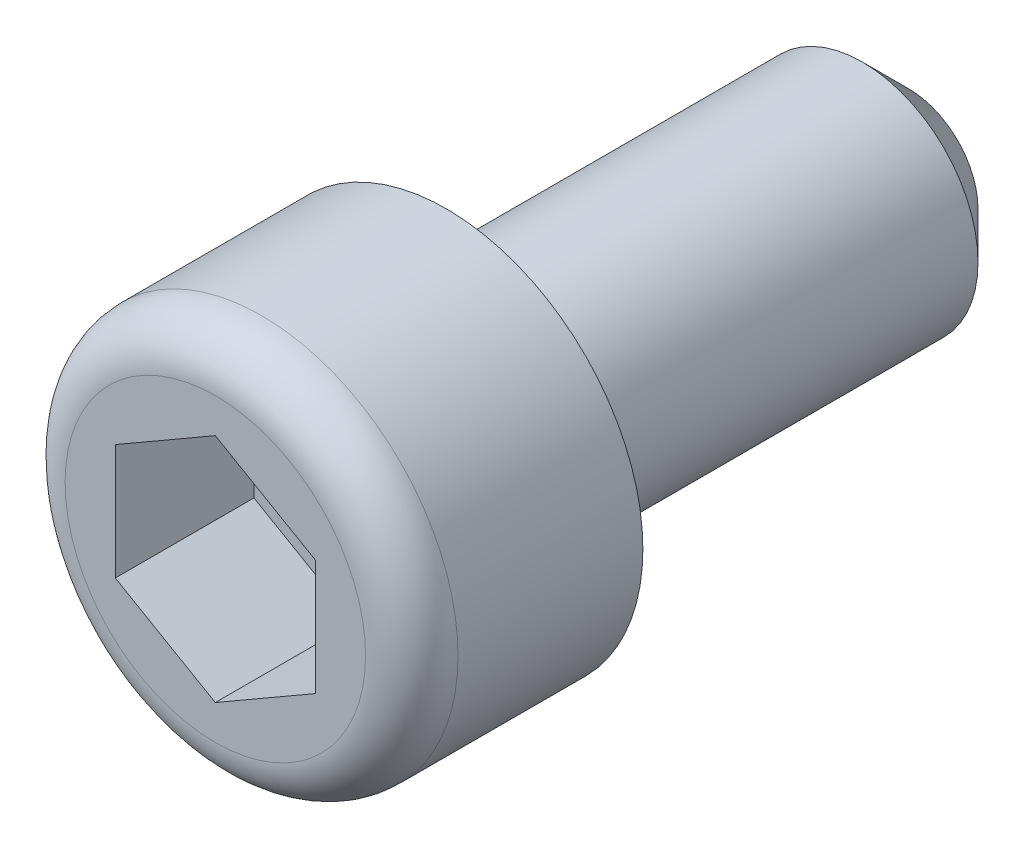
from build123d import *

# Parameters (mm, degrees)
FOOTPRINT_DEPTH = 3
CHAMFER1_SIZE   = 1
FILLET1_R       = 1


with BuildPart() as part:
    # Sketch1 → Body (revolve)
    with BuildSketch(Plane(origin=(0, 0, 0), x_dir=(0, 0, -1), z_dir=(1, 0, 0)), mode=Mode.PRIVATE) as body_sk:
        Polygon((0, 0), (0, 4.25), (5, 4.25), (5, 2.5), (15, 2.5), (15, 0), align=None)
    revolve(body_sk.sketch.rotate(Axis((0, 0, 156.291575099), (0, 0, -1)), 90), axis=Axis((0, 0, 156.291575099), (0, 0, -1)))

    # Sketch2 → Footprint (cut)
    with BuildSketch(Plane.XY):
        Polygon((0, 2.5), (-2.165063509, 1.25), (-2.165063509, -1.25), (0, -2.5), (2.165063509, -1.25), (2.165063509, 1.25), align=None)
    extrude(amount=-FOOTPRINT_DEPTH, mode=Mode.SUBTRACT)

    # Chamfer1
    chamfer1_edges = [part.edges().sort_by_distance(p)[0] for p in [
        (-2.5, 0, -15),
    ]]
    chamfer(chamfer1_edges, length=CHAMFER1_SIZE)

    # Fillet1
    fillet1_edges = [part.edges().sort_by_distance(p)[0] for p in [
        (-4.25, 0, 0),
    ]]
    fillet(fillet1_edges, radius=FILLET1_R)


solid = part.part
